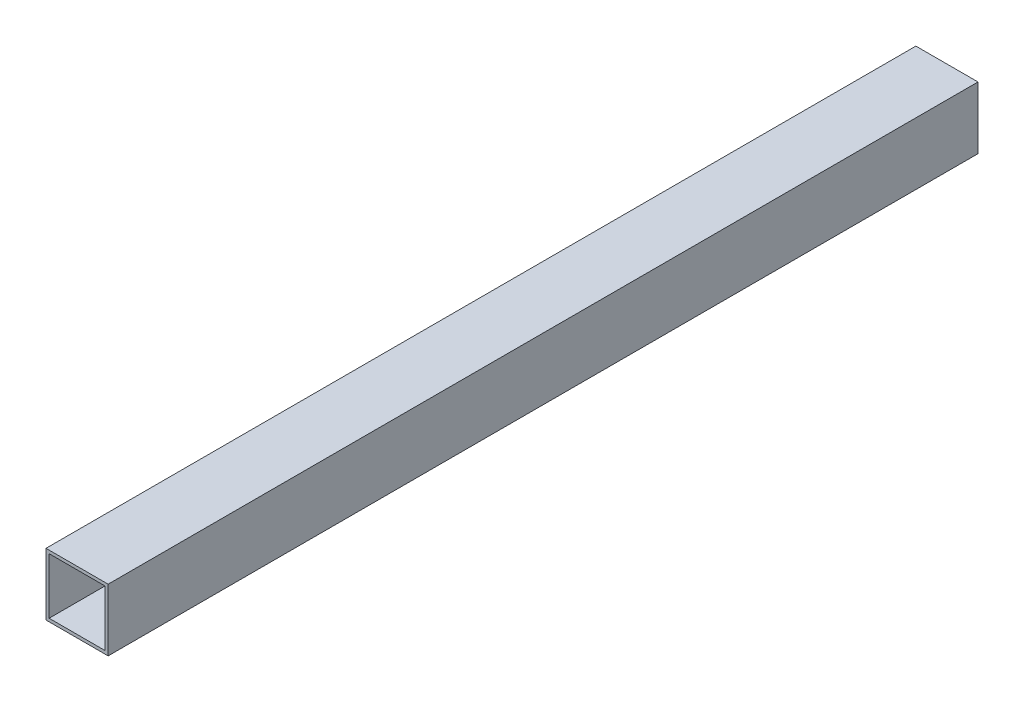
from build123d import *

# Parameters (mm, degrees)
SKETCH_1_W      = 20
SKETCH_1_H      = 20
SKETCH_1_W_2    = 18
SKETCH_1_H_2    = 18
EXTRUDE_1_DEPTH = 280


with BuildPart() as part:
    # 草图1 → 凸台-拉伸1 (new body)
    with BuildSketch(Plane.XY):
        with Locations((2.5, 2.5)):
            Rectangle(SKETCH_1_W, SKETCH_1_H)
        with Locations((2.5, 2.5)):
            Rectangle(SKETCH_1_W_2, SKETCH_1_H_2, mode=Mode.SUBTRACT)
    extrude(amount=EXTRUDE_1_DEPTH)


solid = part.part
